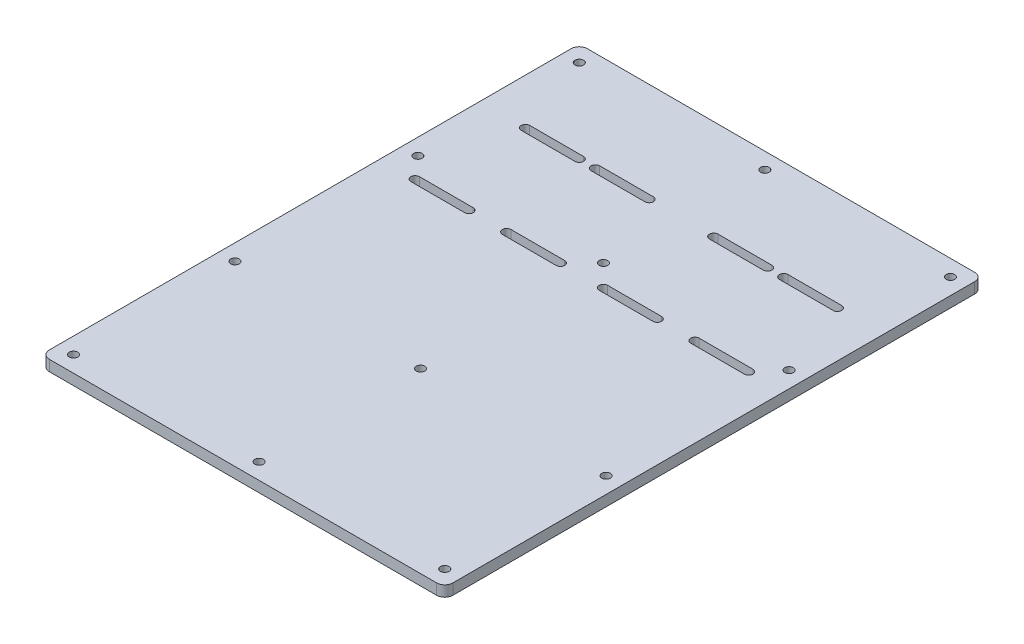
from build123d import *

# Parameters (mm, degrees)
EXTRUDE_1_DEPTH     = 4
SKETCH_3_R          = 1.5875
CUT_EXTRUDE_2_DEPTH = 126.063983624
CUT_EXTRUDE_3_DEPTH = 126.063983624


with BuildPart() as part:
    # Эскиз1 → Бобышка-Вытянуть1 (new body)
    with BuildSketch(Plane(origin=(0, 0, 0), x_dir=(1, 0, 0), z_dir=(0, 1, 0))):
        with BuildLine():
            Line((-72, 100), (72, 100))
            ThreePointArc((72, 100), (74.121320344, 99.121320344), (75, 97))
            Line((75, 97), (75, -97))
            ThreePointArc((75, -97), (74.121320344, -99.121320344), (72, -100))
            Line((72, -100), (-72, -100))
            ThreePointArc((-72, -100), (-74.121320344, -99.121320344), (-75, -97))
            Line((-75, -97), (-75, 97))
            ThreePointArc((-75, 97), (-74.121320344, 99.121320344), (-72, 100))
        make_face()
    extrude(amount=EXTRUDE_1_DEPTH)

    # Эскиз3 → Вырез-Вытянуть2 (cut, through all)
    with BuildSketch(Plane(origin=(0, 4, 0), x_dir=(1, 0, 0), z_dir=(0, 1, 0))):
        with Locations(Location((-69, 94, 0), (0, 0, 270))):
            Circle(SKETCH_3_R)
        with Locations(Location((0, 94, 0), (0, 0, 270))):
            Circle(SKETCH_3_R)
        with Locations(Location((69, 94, 0), (0, 0, 270))):
            Circle(SKETCH_3_R)
        with Locations(Location((-69, -34, 0), (0, 0, 90))):
            Circle(SKETCH_3_R)
        with Locations(Location((69, -34, 0), (0, 0, 90))):
            Circle(SKETCH_3_R)
        with Locations(Location((0, -34, 0), (0, 0, 90))):
            Circle(SKETCH_3_R)
        with Locations(Location((69, -94, 0), (0, 0, 90))):
            Circle(SKETCH_3_R)
        with Locations(Location((0, -94, 0), (0, 0, 90))):
            Circle(SKETCH_3_R)
        with Locations(Location((-69, -94, 0), (0, 0, 90))):
            Circle(SKETCH_3_R)
        with Locations(Location((0, 34, 0), (0, 0, 270))):
            Circle(SKETCH_3_R)
        with Locations(Location((69, 34, 0), (0, 0, 270))):
            Circle(SKETCH_3_R)
        with Locations(Location((-69, 34, 0), (0, 0, 270))):
            Circle(SKETCH_3_R)
    extrude(amount=-CUT_EXTRUDE_2_DEPTH, mode=Mode.SUBTRACT)

    # Эскиз2 → Вырез-Вытянуть3 (cut, through all)
    with BuildSketch(Plane(origin=(0, 4, 0), x_dir=(1, 0, 0), z_dir=(0, 1, 0))):
        with BuildLine():
            Line((-32, 64.5875), (-12, 64.5875))
            ThreePointArc((-12, 64.5875), (-10.4125, 63), (-12, 61.4125))
            Line((-12, 61.4125), (-32, 61.4125))
            ThreePointArc((-32, 61.4125), (-33.5875, 63), (-32, 64.5875))
        make_face()
        with BuildLine():
            Line((-58, 64.5875), (-38, 64.5875))
            ThreePointArc((-38, 64.5875), (-36.4125, 63), (-38, 61.4125))
            Line((-38, 61.4125), (-58, 61.4125))
            ThreePointArc((-58, 61.4125), (-59.5875, 63), (-58, 64.5875))
        make_face()
        with BuildLine():
            Line((-28, 27.5875), (-8, 27.5875))
            ThreePointArc((-8, 27.5875), (-6.4125, 26), (-8, 24.4125))
            Line((-8, 24.4125), (-28, 24.4125))
            ThreePointArc((-28, 24.4125), (-29.5875, 26), (-28, 27.5875))
        make_face()
        with BuildLine():
            Line((-62, 27.5875), (-42, 27.5875))
            ThreePointArc((-42, 27.5875), (-40.4125, 26), (-42, 24.4125))
            Line((-42, 24.4125), (-62, 24.4125))
            ThreePointArc((-62, 24.4125), (-63.5875, 26), (-62, 27.5875))
        make_face()
        with BuildLine():
            Line((62, 24.4125), (42, 24.4125))
            ThreePointArc((42, 24.4125), (40.4125, 26), (42, 27.5875))
            Line((42, 27.5875), (62, 27.5875))
            ThreePointArc((62, 27.5875), (63.5875, 26), (62, 24.4125))
        make_face()
        with BuildLine():
            Line((28, 24.4125), (8, 24.4125))
            ThreePointArc((8, 24.4125), (6.4125, 26), (8, 27.5875))
            Line((8, 27.5875), (28, 27.5875))
            ThreePointArc((28, 27.5875), (29.5875, 26), (28, 24.4125))
        make_face()
        with BuildLine():
            Line((58, 61.4125), (38, 61.4125))
            ThreePointArc((38, 61.4125), (36.4125, 63), (38, 64.5875))
            Line((38, 64.5875), (58, 64.5875))
            ThreePointArc((58, 64.5875), (59.5875, 63), (58, 61.4125))
        make_face()
        with BuildLine():
            Line((32, 61.4125), (12, 61.4125))
            ThreePointArc((12, 61.4125), (10.4125, 63), (12, 64.5875))
            Line((12, 64.5875), (32, 64.5875))
            ThreePointArc((32, 64.5875), (33.5875, 63), (32, 61.4125))
        make_face()
    extrude(amount=-CUT_EXTRUDE_3_DEPTH, mode=Mode.SUBTRACT)


solid = part.part
